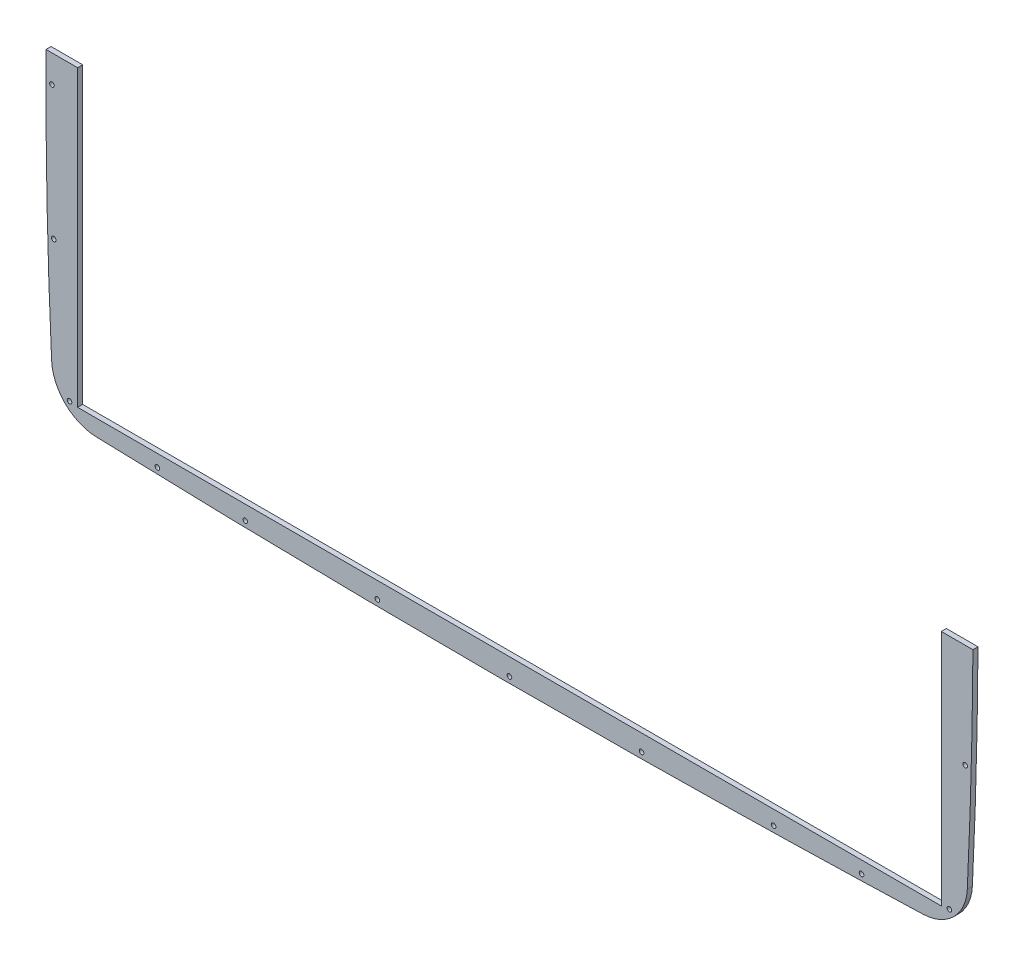
from build123d import *

# Parameters (mm, degrees)
SKETCH1_R           = 1.435
SKETCH1_R_2         = 1.4351
BOSS_EXTRUDE1_DEPTH = 3.175
SKETCH2_W           = 534.158263194
SKETCH2_H           = 314.627770006
SKETCH2_R           = 1.4351
CUT_EXTRUDE1_DEPTH  = 342.698968356
CUT_EXTRUDE2_DEPTH  = 342.698968356


with BuildPart() as part:
    # Sketch1 → Boss-Extrude1 (new body)
    with BuildSketch(Plane.XY):
        with BuildLine():
            ThreePointArc((2.968751211, -181.189695026), (41.295889155, -181.079537948), (79.6220041, -180.778621425))
            Line((79.6220041, -180.778621425), (85.559165015, -180.714940362))
            ThreePointArc((85.559165015, -180.714940362), (123.887667874, -180.193645916), (162.213100977, -179.481566675))
            ThreePointArc((162.213100977, -179.481566675), (165.18118139, -179.418457741), (168.149237253, -179.35420455))
            ThreePointArc((168.149237253, -179.35420455), (192.659124698, -178.779845314), (217.167059321, -178.127456184))
            ThreePointArc((217.167059321, -178.127456184), (220.135246662, -178.043143258), (223.103401271, -177.957685792))
            Line((223.103401271, -177.957685792), (258.423629847, -176.852835003))
            ThreePointArc((258.423629847, -176.852835003), (267.290868319, -175.133004675), (275.18450496, -170.742533734))
            ThreePointArc((275.18450496, -170.742533734), (277.610750544, -168.6061656), (279.781359306, -166.210504095))
            ThreePointArc((279.781359306, -166.210504095), (284.283709644, -158.379432473), (286.129131597, -149.53685032))
            ThreePointArc((286.129131597, -149.53685032), (287.482131945, -117.828809116), (288.512976487, -86.108660213))
            ThreePointArc((288.512976487, -86.108660213), (288.592974065, -83.139049998), (288.670148028, -80.169365063))
            ThreePointArc((288.670148028, -80.169365063), (289.416235277, -41.572865854), (289.685382101, -2.970094485))
            ThreePointArc((289.685382101, -2.970094485), (289.686328933, 0.0005929), (289.684451162, 2.971279842))
            ThreePointArc((289.684451162, 2.971279842), (289.409759592, 41.084465923), (288.670148028, 79.191465063))
            ThreePointArc((288.670148028, 79.191465063), (288.592974065, 82.161149998), (288.512976487, 85.130760213))
            ThreePointArc((288.512976487, 85.130760213), (287.482131945, 116.850909116), (286.129131597, 148.55895032))
            ThreePointArc((286.129131597, 148.55895032), (284.283709644, 157.401532473), (279.781359306, 165.232604095))
            ThreePointArc((279.781359306, 165.232604095), (277.610750544, 167.6282656), (275.18450496, 169.764633734))
            ThreePointArc((275.18450496, 169.764633734), (267.290868319, 174.155104675), (258.423629847, 175.874935003))
            ThreePointArc((258.423629847, 175.874935003), (240.76414932, 176.447620699), (223.103401271, 176.979785792))
            ThreePointArc((223.103401271, 176.979785792), (220.135246662, 177.065243258), (217.167059321, 177.149556184))
            ThreePointArc((217.167059321, 177.149556184), (192.659124698, 177.801945314), (168.149237253, 178.37630455))
            ThreePointArc((168.149237253, 178.37630455), (165.18118139, 178.440557741), (162.213100977, 178.503666675))
            ThreePointArc((162.213100977, 178.503666675), (123.887667874, 179.215745916), (85.559165015, 179.737040362))
            ThreePointArc((85.559165015, 179.737040362), (82.590590695, 179.769453121), (79.6220041, 179.800721425))
            ThreePointArc((79.6220041, 179.800721425), (41.295889155, 180.101637948), (2.968751211, 180.211795026))
            ThreePointArc((2.968751211, 180.211795026), (0, 180.212367286), (-2.968751211, 180.211795026))
            ThreePointArc((-2.968751211, 180.211795026), (-41.295889155, 180.101637948), (-79.6220041, 179.800721425))
            ThreePointArc((-79.6220041, 179.800721425), (-82.590590695, 179.769453121), (-85.559165015, 179.737040362))
            ThreePointArc((-85.559165015, 179.737040362), (-123.887667874, 179.215745916), (-162.213100977, 178.503666675))
            ThreePointArc((-162.213100977, 178.503666675), (-165.18118139, 178.440557741), (-168.149237253, 178.37630455))
            ThreePointArc((-168.149237253, 178.37630455), (-192.659124698, 177.801945314), (-217.167059321, 177.149556184))
            ThreePointArc((-217.167059321, 177.149556184), (-220.135246662, 177.065243258), (-223.103401271, 176.979785792))
            ThreePointArc((-223.103401271, 176.979785792), (-240.76414932, 176.447620699), (-258.423629847, 175.874935003))
            ThreePointArc((-258.423629847, 175.874935003), (-267.290868319, 174.155104675), (-275.18450496, 169.764633734))
            ThreePointArc((-275.18450496, 169.764633734), (-277.610750544, 167.6282656), (-279.781359306, 165.232604095))
            ThreePointArc((-279.781359306, 165.232604095), (-284.283709644, 157.401532473), (-286.129131597, 148.55895032))
            ThreePointArc((-286.129131597, 148.55895032), (-287.482131945, 116.850909116), (-288.512976487, 85.130760213))
            ThreePointArc((-288.512976487, 85.130760213), (-288.592974065, 82.161149998), (-288.670148028, 79.191465063))
            ThreePointArc((-288.670148028, 79.191465063), (-289.409759592, 41.084465923), (-289.684451162, 2.971279842))
            ThreePointArc((-289.684451162, 2.971279842), (-289.686328933, 0.0005929), (-289.685382101, -2.970094485))
            ThreePointArc((-289.685382101, -2.970094485), (-289.416235277, -41.572865854), (-288.670148028, -80.169365063))
            ThreePointArc((-288.670148028, -80.169365063), (-288.592974065, -83.139049998), (-288.512976487, -86.108660213))
            ThreePointArc((-288.512976487, -86.108660213), (-287.482131945, -117.828809116), (-286.129131597, -149.53685032))
            ThreePointArc((-286.129131597, -149.53685032), (-284.283709644, -158.379432473), (-279.781359306, -166.210504095))
            ThreePointArc((-279.781359306, -166.210504095), (-277.610750544, -168.6061656), (-275.18450496, -170.742533734))
            ThreePointArc((-275.18450496, -170.742533734), (-267.290868319, -175.133004675), (-258.423629847, -176.852835003))
            ThreePointArc((-258.423629847, -176.852835003), (-240.76414932, -177.425520699), (-223.103401271, -177.957685792))
            ThreePointArc((-223.103401271, -177.957685792), (-220.135246662, -178.043143258), (-217.167059321, -178.127456184))
            ThreePointArc((-217.167059321, -178.127456184), (-192.659124698, -178.779845314), (-168.149237253, -179.35420455))
            ThreePointArc((-168.149237253, -179.35420455), (-165.18118139, -179.418457741), (-162.213100977, -179.481566675))
            ThreePointArc((-162.213100977, -179.481566675), (-123.887667874, -180.193645916), (-85.559165015, -180.714940362))
            ThreePointArc((-85.559165015, -180.714940362), (-82.590590695, -180.747353121), (-79.6220041, -180.778621425))
            ThreePointArc((-79.6220041, -180.778621425), (-41.295889155, -181.079537948), (-2.968751211, -181.189695026))
            ThreePointArc((-2.968751211, -181.189695026), (0, -181.190267286), (2.968751211, -181.189695026))
        make_face()
        with Locations((-274.954150451, -165.911566346)):
            Circle(SKETCH1_R, mode=Mode.SUBTRACT)
        with Locations((-220.027075225, -174.260724966)):
            Circle(SKETCH1_R_2, mode=Mode.SUBTRACT)
        with Locations((-165.1, -175.63472853)):
            Circle(SKETCH1_R_2, mode=Mode.SUBTRACT)
        with Locations((-82.55, -176.962970799)):
            Circle(SKETCH1_R_2, mode=Mode.SUBTRACT)
        with Locations((0, -177.405667286)):
            Circle(SKETCH1_R_2, mode=Mode.SUBTRACT)
        with Locations((-284.81033356, -83.03895)):
            Circle(SKETCH1_R_2, mode=Mode.SUBTRACT)
        with Locations((82.55, -176.962970799)):
            Circle(SKETCH1_R_2, mode=Mode.SUBTRACT)
        with Locations((165.1, -175.63472853)):
            Circle(SKETCH1_R_2, mode=Mode.SUBTRACT)
        with Locations((220.027075225, -174.260724966)):
            Circle(SKETCH1_R_2, mode=Mode.SUBTRACT)
        with Locations((274.954150451, -165.911566346)):
            Circle(SKETCH1_R_2, mode=Mode.SUBTRACT)
        with Locations((284.81033356, -83.03895)):
            Circle(SKETCH1_R_2, mode=Mode.SUBTRACT)
        with Locations((-285.902364234, 0)):
            Circle(SKETCH1_R_2, mode=Mode.SUBTRACT)
        with Locations((-284.81033356, 82.06105)):
            Circle(SKETCH1_R_2, mode=Mode.SUBTRACT)
        with Locations((-274.954150451, 164.933666346)):
            Circle(SKETCH1_R_2, mode=Mode.SUBTRACT)
        with Locations((-220.027075225, 173.282824966)):
            Circle(SKETCH1_R_2, mode=Mode.SUBTRACT)
        with Locations((-165.1, 174.65682853)):
            Circle(SKETCH1_R_2, mode=Mode.SUBTRACT)
        with Locations((-82.55, 175.985070799)):
            Circle(SKETCH1_R_2, mode=Mode.SUBTRACT)
        with Locations((0, 176.427767286)):
            Circle(SKETCH1_R_2, mode=Mode.SUBTRACT)
        with Locations((285.902364234, 0)):
            Circle(SKETCH1_R_2, mode=Mode.SUBTRACT)
        with Locations((284.81033356, 82.06105)):
            Circle(SKETCH1_R_2, mode=Mode.SUBTRACT)
        with Locations((82.55, 175.985070799)):
            Circle(SKETCH1_R_2, mode=Mode.SUBTRACT)
        with Locations((165.1, 174.65682853)):
            Circle(SKETCH1_R_2, mode=Mode.SUBTRACT)
        with Locations((220.027075225, 173.282824966)):
            Circle(SKETCH1_R_2, mode=Mode.SUBTRACT)
        with Locations((274.954150451, 164.933666346)):
            Circle(SKETCH1_R_2, mode=Mode.SUBTRACT)
    extrude(amount=BOSS_EXTRUDE1_DEPTH)

    # Sketch2 → Cut-Extrude1 (cut, through all)
    # profile 1 of 3: a face of its own
    with BuildSketch(Plane(origin=(0, 0, 0), x_dir=(-1, 0, 0), z_dir=(0, 0, -1))):
        with Locations((0, -0.48895)):
            Rectangle(SKETCH2_W, SKETCH2_H)
    # profile 2 of 3: a face of its own
    with BuildSketch(Plane(origin=(0, 0, 0), x_dir=(-1, 0, 0), z_dir=(0, 0, -1))):
        with BuildLine():
            Line((267.079131597, 156.824935003), (267.079131597, 17.124935003))
            Line((267.079131597, 17.124935003), (289.636716357, 17.124935003))
            ThreePointArc((289.636716357, 17.124935003), (288.574391594, 82.860395885), (286.129131597, 148.55895032))
            ThreePointArc((286.129131597, 148.55895032), (277.611193872, 167.627828514), (258.423629847, 175.874935003))
            ThreePointArc((258.423629847, 175.874935003), (0, 180.212367286), (-258.423629847, 175.874935003))
            ThreePointArc((-258.423629847, 175.874935003), (-277.611193872, 167.627828514), (-286.129131597, 148.55895032))
            ThreePointArc((-286.129131597, 148.55895032), (-288.994653482, 65.251455257), (-289.636716357, -18.102835003))
            Line((-289.636716357, -18.102835003), (-267.079131597, -18.102835003))
            Line((-267.079131597, -18.102835003), (-267.079131597, 156.824935003))
            Line((-267.079131597, 156.824935003), (267.079131597, 156.824935003))
        make_face()
        with Locations((-285.902364234, 0)):
            Circle(SKETCH2_R, mode=Mode.SUBTRACT)
        with Locations((-284.81033356, 82.06105)):
            Circle(SKETCH2_R, mode=Mode.SUBTRACT)
        with Locations((-274.954150451, 164.933666346)):
            Circle(SKETCH2_R, mode=Mode.SUBTRACT)
        with Locations((-220.027075225, 173.282824966)):
            Circle(SKETCH2_R, mode=Mode.SUBTRACT)
        with Locations((-165.1, 174.65682853)):
            Circle(SKETCH2_R, mode=Mode.SUBTRACT)
        with Locations((-82.55, 175.985070799)):
            Circle(SKETCH2_R, mode=Mode.SUBTRACT)
        with Locations((284.81033356, 82.06105)):
            Circle(SKETCH2_R, mode=Mode.SUBTRACT)
        with Locations((0, 176.427767286)):
            Circle(SKETCH2_R, mode=Mode.SUBTRACT)
        with Locations((82.55, 175.985070799)):
            Circle(SKETCH2_R, mode=Mode.SUBTRACT)
        with Locations((274.954150451, 164.933666346)):
            Circle(SKETCH2_R, mode=Mode.SUBTRACT)
        with Locations((165.1, 174.65682853)):
            Circle(SKETCH2_R, mode=Mode.SUBTRACT)
        with Locations((220.027075225, 173.282824966)):
            Circle(SKETCH2_R, mode=Mode.SUBTRACT)
    # profile 3 of 3: a face of its own
    with BuildSketch(Plane(origin=(0, 0, 0), x_dir=(-1, 0, 0), z_dir=(0, 0, -1))):
        with BuildLine():
            ThreePointArc((286.129131597, 148.55895032), (288.574391594, 82.860395885), (289.636716357, 17.124935003))
            Line((289.636716357, 17.124935003), (305.179131597, 17.124935003))
            Line((305.179131597, 17.124935003), (305.179131597, 212.688590186))
            Line((305.179131597, 212.688590186), (-305.179131597, 212.688590186))
            Line((-305.179131597, 212.688590186), (-305.179131597, -18.102835003))
            Line((-305.179131597, -18.102835003), (-289.636716357, -18.102835003))
            ThreePointArc((-289.636716357, -18.102835003), (-288.994653482, 65.251455257), (-286.129131597, 148.55895032))
            ThreePointArc((-286.129131597, 148.55895032), (-277.611193872, 167.627828514), (-258.423629847, 175.874935003))
            ThreePointArc((-258.423629847, 175.874935003), (0, 180.212367286), (258.423629847, 175.874935003))
            ThreePointArc((258.423629847, 175.874935003), (277.611193872, 167.627828514), (286.129131597, 148.55895032))
        make_face()
    extrude(amount=-CUT_EXTRUDE1_DEPTH, mode=Mode.SUBTRACT)

    # Sketch3 → Cut-Extrude2 (cut, through all)
    with BuildSketch(Plane(origin=(0, 0, 0), x_dir=(-1, 0, 0), z_dir=(0, 0, -1))):
        Polygon((-269.875, 17.124935003), (-269.875, -18.102835003), (-267.079131597, -18.102835003), (-267.079131597, -157.802835003), (267.079131597, -157.802835003), (267.079131597, 17.124935003), align=None)
        Polygon((-269.875, -166.692835003), (269.875, -166.692835003), (269.875, 17.124935003), (267.079131597, 17.124935003), (267.079131597, -157.802835003), (-267.079131597, -157.802835003), (-267.079131597, -18.102835003), (-269.875, -18.102835003), align=None)
    extrude(amount=-CUT_EXTRUDE2_DEPTH, mode=Mode.SUBTRACT)


solid = part.part
